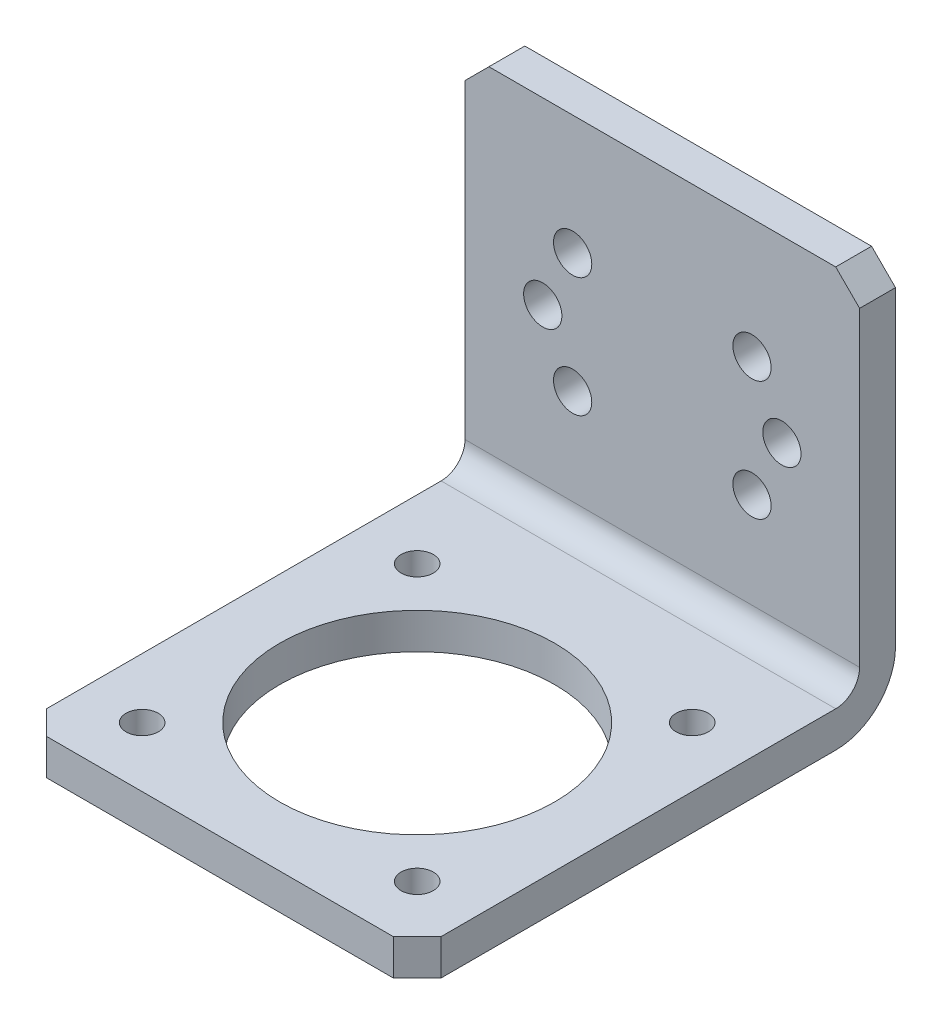
from build123d import *

# Parameters (mm, degrees)
SKETCH_5_R          = 11.5
SKETCH_5_R_2        = 1.35
EXTRUDE_3_DEPTH     = 3
SKETCH_8_W          = 33
SKETCH_8_H          = 3
EXTRUDE_4_DEPTH     = 30
SKETCH_10_R         = 1.6
CUT_EXTRUDE_4_DEPTH = 5
FILLET_1_R          = 2
FILLET_2_R          = 5
CHAMFER_1_SIZE      = 2


with BuildPart() as part:
    # 草图5 → 凸台-拉伸3 (new body)
    with BuildSketch(Plane(origin=(0, 0, 0), x_dir=(1, 0, 0), z_dir=(0, 1, 0))):
        Polygon((16.5, 23.5), (16.5, -14.5), (14.5, -16.5), (-14.5, -16.5), (-16.5, -14.5), (-16.5, 23.5), align=None)
        with Locations(Location((0, 0, 0), (0, 0, 270))):
            Circle(SKETCH_5_R, mode=Mode.SUBTRACT)
        with Locations(Location((-11.5, -11.5, 0), (0, 0, 270))):
            Circle(SKETCH_5_R_2, mode=Mode.SUBTRACT)
        with Locations(Location((-11.5, 11.5, 0), (0, 0, 270))):
            Circle(SKETCH_5_R_2, mode=Mode.SUBTRACT)
        with Locations(Location((11.5, 11.5, 0), (0, 0, 270))):
            Circle(SKETCH_5_R_2, mode=Mode.SUBTRACT)
        with Locations(Location((11.5, -11.5, 0), (0, 0, 270))):
            Circle(SKETCH_5_R_2, mode=Mode.SUBTRACT)
    extrude(amount=EXTRUDE_3_DEPTH)

    # 草图8 → 凸台-拉伸4 (add)
    with BuildSketch(Plane(origin=(0, 3, 0), x_dir=(1, 0, 0), z_dir=(0, 1, 0))):
        with Locations((0, 22)):
            Rectangle(SKETCH_8_W, SKETCH_8_H)
    extrude(amount=EXTRUDE_4_DEPTH)

    # 草图10 → 切除-拉伸4 (cut)
    with BuildSketch(Plane.XY.offset(-20.5)):
        with Locations((-7.5, 23)):
            Circle(SKETCH_10_R)
        with Locations((7.5, 23)):
            Circle(SKETCH_10_R)
        with Locations((7.5, 13)):
            Circle(SKETCH_10_R)
        with Locations((-7.5, 13)):
            Circle(SKETCH_10_R)
        with Locations((-10, 18)):
            Circle(SKETCH_10_R)
        with Locations((10, 18)):
            Circle(SKETCH_10_R)
    extrude(amount=-CUT_EXTRUDE_4_DEPTH, mode=Mode.SUBTRACT)

    # 圆角1
    fillet_1_edges = [part.edges().sort_by_distance(p)[0] for p in [
        (0, 3, -20.5),
    ]]
    fillet(fillet_1_edges, radius=FILLET_1_R)

    # 圆角2
    fillet_2_edges = [part.edges().sort_by_distance(p)[0] for p in [
        (0, 0, -23.5),
    ]]
    fillet(fillet_2_edges, radius=FILLET_2_R)

    # 倒角1
    chamfer_1_edges = [part.edges().sort_by_distance(p)[0] for p in [
        (-16.5, 33, -22),
        (16.5, 33, -22),
    ]]
    chamfer(chamfer_1_edges, length=CHAMFER_1_SIZE)


solid = part.part
